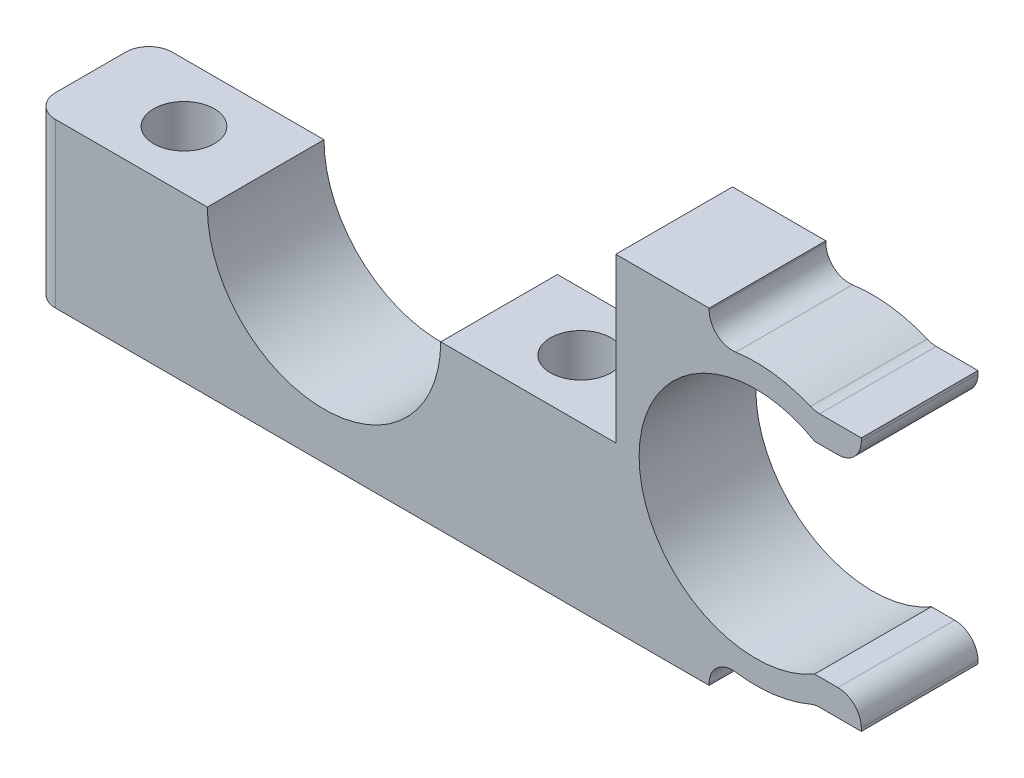
from build123d import *

# Parameters (mm, degrees)
BOSS_EXTRUDE1_DEPTH = 10
FILLET1_R           = 2
SKETCH4_R           = 2.6
CUT_EXTRUDE2_DEPTH  = 50.150169347


with BuildPart() as part:
    # Sketch1 → Boss-Extrude1 (new body)
    with BuildSketch(Plane.XY):
        with BuildLine():
            Line((10, 0), (25, 0))
            Line((25, 0), (25, 14))
            Line((25, 14), (33, 14))
            Line((33, 14), (33, 11.313708499))
            ThreePointArc((33, 11.313708499), (37.561789374, 11.986842482), (42.040624961, 10.89))
            Line((42.040624961, 10.89), (46.040624961, 10.89))
            Line((46.040624961, 10.89), (46.040624961, 8.636671813))
            Line((46.040624961, 8.636671813), (42.040624961, 8.636671813))
            ThreePointArc((42.040624961, 8.636671813), (27, 0), (42.040624961, -8.636671813))
            Line((42.040624961, -8.636671813), (46.040624961, -8.636671813))
            Line((46.040624961, -8.636671813), (46.040624961, -10.89))
            Line((46.040624961, -10.89), (42.040624961, -10.89))
            ThreePointArc((42.040624961, -10.89), (37.561789374, -11.986842482), (33, -11.313708499))
            Line((33, -11.313708499), (33, -14))
            Line((33, -14), (25, -14))
            Line((25, -14), (-25, -14))
            Line((-25, -14), (-25, 0))
            Line((-25, 0), (-10, 0))
            ThreePointArc((-10, 0), (0, -10), (10, 0))
        make_face()
    extrude(amount=BOSS_EXTRUDE1_DEPTH)

    # Fillet1
    fillet1_edges = [part.edges().sort_by_distance(p)[0] for p in [
        (-25, -7, 10),
        (-25, -7, 0),
        (33, 11.313708499, 5),
        (42.040624961, 10.89, 5),
        (46.040624961, 8.636671813, 5),
        (46.040624961, -8.636671813, 5),
        (42.040624961, -10.89, 5),
        (33, -11.313708499, 5),
    ]]
    fillet(fillet1_edges, radius=FILLET1_R)

    # Sketch4 → Cut-Extrude2 (cut, through all)
    with BuildSketch(Plane(origin=(0, 0, 0), x_dir=(1, 0, 0), z_dir=(0, 1, 0))):
        with Locations(Location((-17, -5, 0), (0, 0, 180))):
            Circle(SKETCH4_R)
        with Locations(Location((17, -5, 0), (0, 0, 180))):
            Circle(SKETCH4_R)
    extrude(amount=-CUT_EXTRUDE2_DEPTH, mode=Mode.SUBTRACT)


solid = part.part
